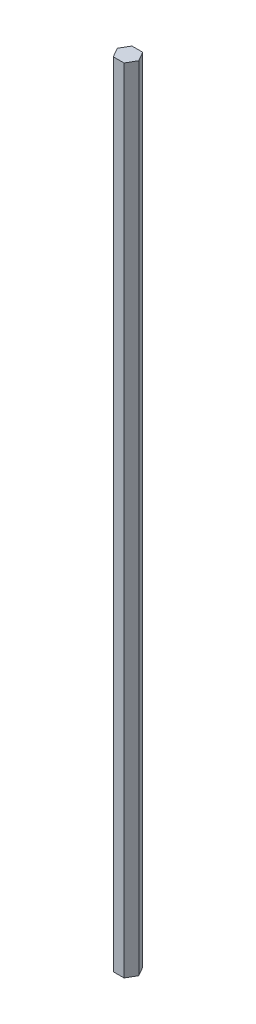
from build123d import *

# Parameters (mm, degrees)
BOSS_EXTRUDE1_DEPTH = 539.75


with BuildPart() as part:
    # Sketch1 → Boss-Extrude1 (new body)
    with BuildSketch(Plane(origin=(0, 0, 0), x_dir=(1, 0, 0), z_dir=(0, 1, 0))):
        Polygon((7.332348419, 0), (3.666174209, 6.35), (-3.666174209, 6.35), (-7.332348419, 0), (-3.666174209, -6.35), (3.666174209, -6.35), align=None)
    extrude(amount=BOSS_EXTRUDE1_DEPTH)


solid = part.part
